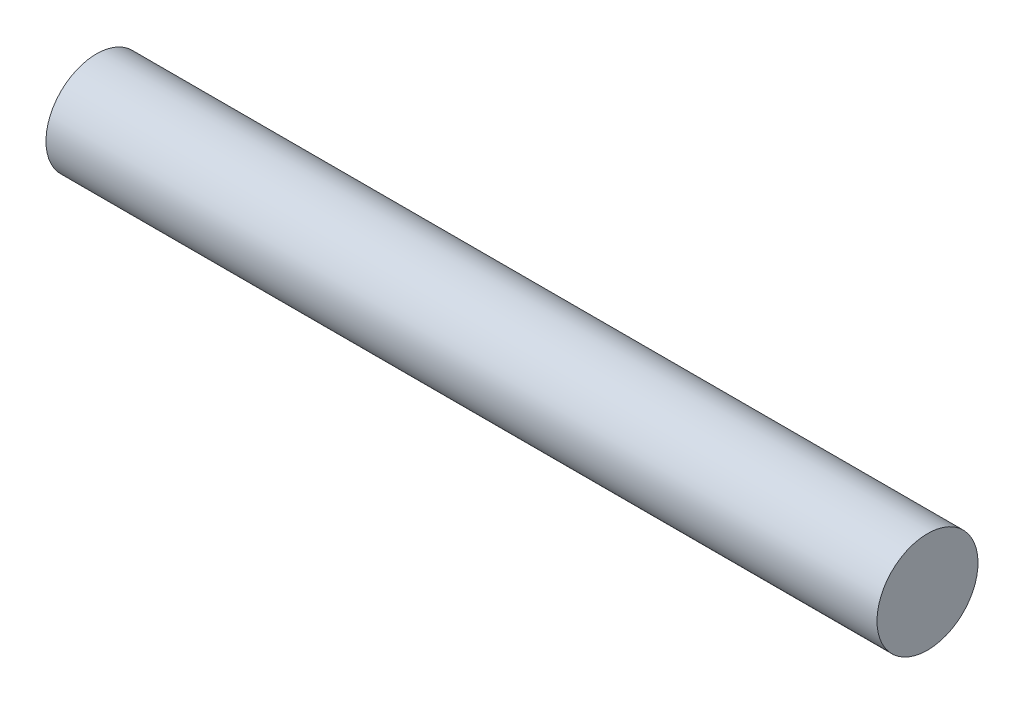
from build123d import *

# Parameters (mm, degrees)
SKETCH1_R           = 3.57
BOSS_EXTRUDE1_DEPTH = 58.7248


with BuildPart() as part:
    # Sketch1 → Boss-Extrude1 (new body)
    with BuildSketch(Plane(origin=(0, 0, 0), x_dir=(0, 0, -1), z_dir=(1, 0, 0))):
        with Locations(Location((0, 0, 0), (0, 0, 270))):
            Circle(SKETCH1_R)
    extrude(amount=BOSS_EXTRUDE1_DEPTH)


solid = part.part
